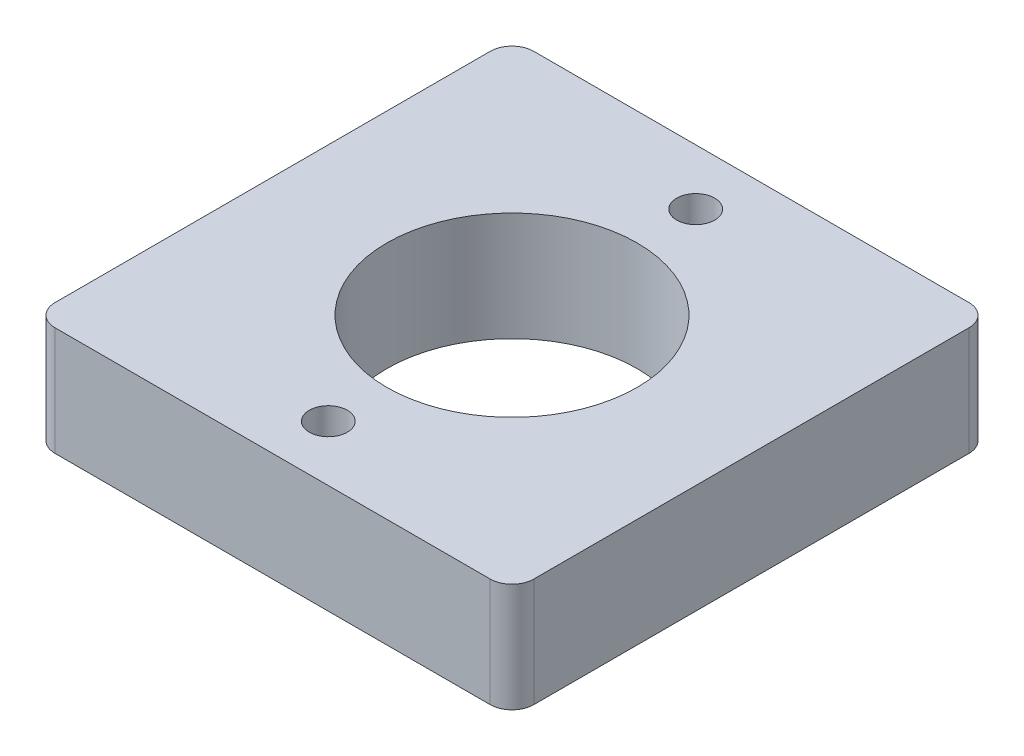
from build123d import *

# Parameters (mm, degrees)
CROQUIS1_W              = 44
CROQUIS1_H              = 44
CROQUIS1_R              = 11.5
SALIENTE_EXTRUIR1_DEPTH = 10
CROQUIS2_R              = 1.75
CORTAR_EXTRUIR1_DEPTH   = 33.680269277
REDONDEO1_R             = 2


with BuildPart() as part:
    # Croquis1 → Saliente-Extruir1 (new body)
    with BuildSketch(Plane(origin=(0, 0, 0), x_dir=(1, 0, 0), z_dir=(0, 1, 0))):
        Rectangle(CROQUIS1_W, CROQUIS1_H)
        with Locations(Location((0, 0, 0), (0, 0, 270))):
            Circle(CROQUIS1_R, mode=Mode.SUBTRACT)
    extrude(amount=SALIENTE_EXTRUIR1_DEPTH)

    # Croquis2 → Cortar-Extruir1 (cut, through all)
    with BuildSketch(Plane(origin=(0, 10, 0), x_dir=(1, 0, 0), z_dir=(0, 1, 0))):
        with Locations(Location((0, 16.88, 0), (0, 0, 270))):
            Circle(CROQUIS2_R)
        with Locations(Location((0, -16.88, 0), (0, 0, 270))):
            Circle(CROQUIS2_R)
    extrude(amount=-CORTAR_EXTRUIR1_DEPTH, mode=Mode.SUBTRACT)

    # Redondeo1
    redondeo1_edges = [part.edges().sort_by_distance(p)[0] for p in [
        (22, 5, 22),
        (-22, 5, 22),
        (-22, 5, -22),
        (22, 5, -22),
    ]]
    fillet(redondeo1_edges, radius=REDONDEO1_R)


solid = part.part
